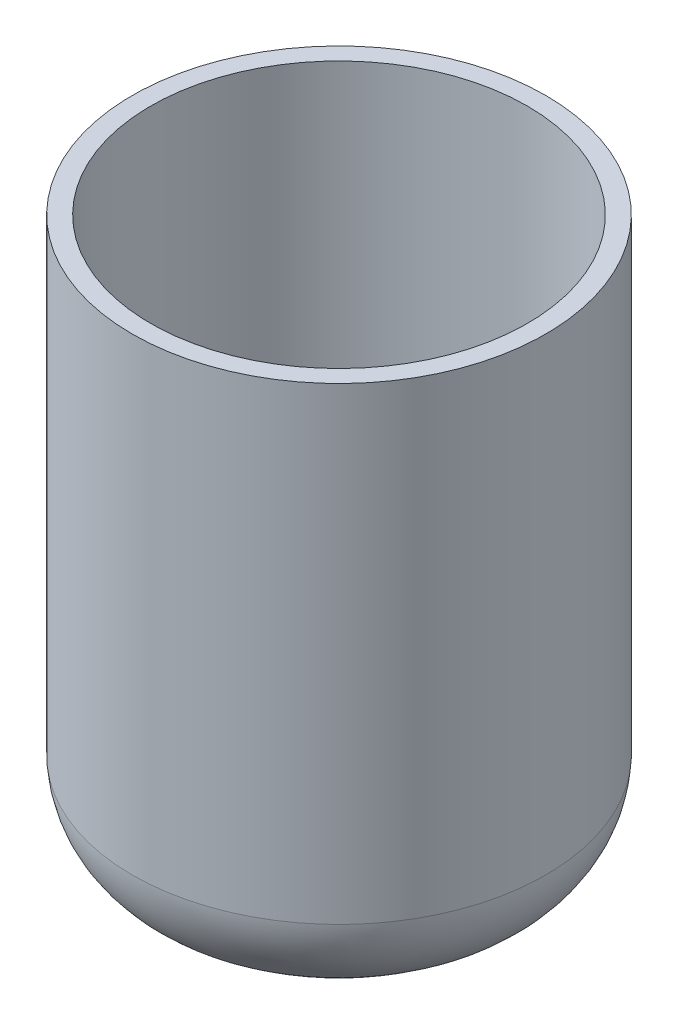
from build123d import *


with BuildPart() as part:
    # 草图1 → 旋转-薄壁1 (revolve)
    with BuildSketch(Plane.XY, mode=Mode.PRIVATE) as revolve_1_sk:
        with BuildLine():
            Line((225.25, 0), (225.25, -510.514878882))
            ThreePointArc((225.25, -510.514878882), (201.057365828, -573.109334713), (145, -610))
            Line((145, -610), (0, -610))
            Line((0, -610), (0, -590))
            Line((0, -590), (142.122341449, -590))
            ThreePointArc((142.122341449, -590), (186.127746808, -559.753326209), (205.25, -509.896767873))
            Line((205.25, -509.896767873), (205.25, 0))
            Line((205.25, 0), (225.25, 0))
        make_face()
    revolve(revolve_1_sk.sketch.rotate(Axis((0, -610, 0), (0, 1, 0)), 90), axis=Axis((0, -610, 0), (0, 1, 0)))


solid = part.part
